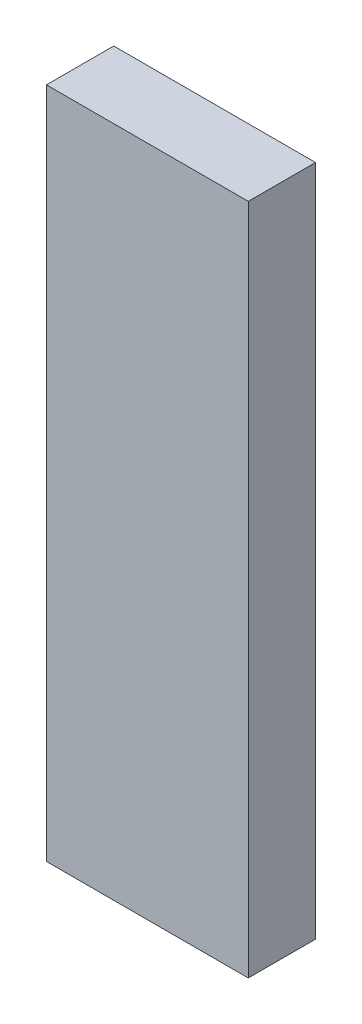
from build123d import *

# Parameters (mm, degrees)
EXTRUDE_1_DEPTH      = 30
EXTRUDE_1_DEPTH_BACK = 30
SKETCH_1_W           = 20
SKETCH_1_H           = 200


with BuildPart() as part:
    # 草图1 → 凸台-拉伸1 (new, two sides: drawn at the far end of the back side and taken through both)
    with BuildSketch(Plane(origin=(0, 0, 0), x_dir=(0, 0, -1), z_dir=(1, 0, 0)).offset(-EXTRUDE_1_DEPTH_BACK)):
        Rectangle(SKETCH_1_W, SKETCH_1_H)
    extrude(amount=EXTRUDE_1_DEPTH + EXTRUDE_1_DEPTH_BACK)


solid = part.part
